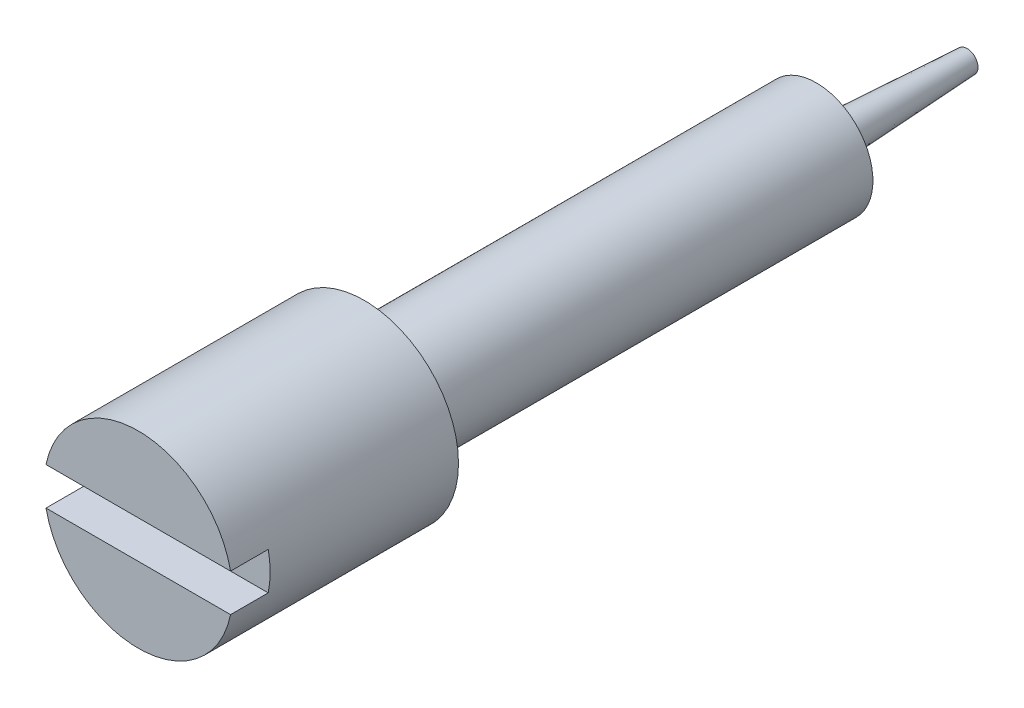
from build123d import *

# Parameters (mm, degrees)
SKETCH1_R           = 2.5
BOSS_EXTRUDE1_DEPTH = 6
SKETCH2_W           = 5.368595506
SKETCH2_H           = 1
CUT_EXTRUDE1_DEPTH  = 1
SKETCH3_R           = 1.5
BOSS_EXTRUDE2_DEPTH = 12
SKETCH4_R           = 0.5
BOSS_EXTRUDE3_DEPTH = 4
BOSS_EXTRUDE3_TAPER = 3


with BuildPart() as part:
    # Sketch1 → Boss-Extrude1 (new body)
    with BuildSketch(Plane.XY):
        Circle(SKETCH1_R)
    extrude(amount=BOSS_EXTRUDE1_DEPTH)

    # Sketch2 → Cut-Extrude1 (cut)
    with BuildSketch(Plane.XY.offset(6)):
        Rectangle(SKETCH2_W, SKETCH2_H)
    extrude(amount=-CUT_EXTRUDE1_DEPTH, mode=Mode.SUBTRACT)

    # Sketch3 → Boss-Extrude2 (add)
    with BuildSketch(Plane(origin=(0, 0, 0), x_dir=(-1, 0, 0), z_dir=(0, 0, -1))):
        Circle(SKETCH3_R)
    extrude(amount=BOSS_EXTRUDE2_DEPTH)

    # Sketch4 → Boss-Extrude3 (add)
    with BuildSketch(Plane(origin=(0, 0, -12), x_dir=(-1, 0, 0), z_dir=(0, 0, -1))):
        Circle(SKETCH4_R)
    extrude(amount=BOSS_EXTRUDE3_DEPTH, taper=BOSS_EXTRUDE3_TAPER)


solid = part.part
